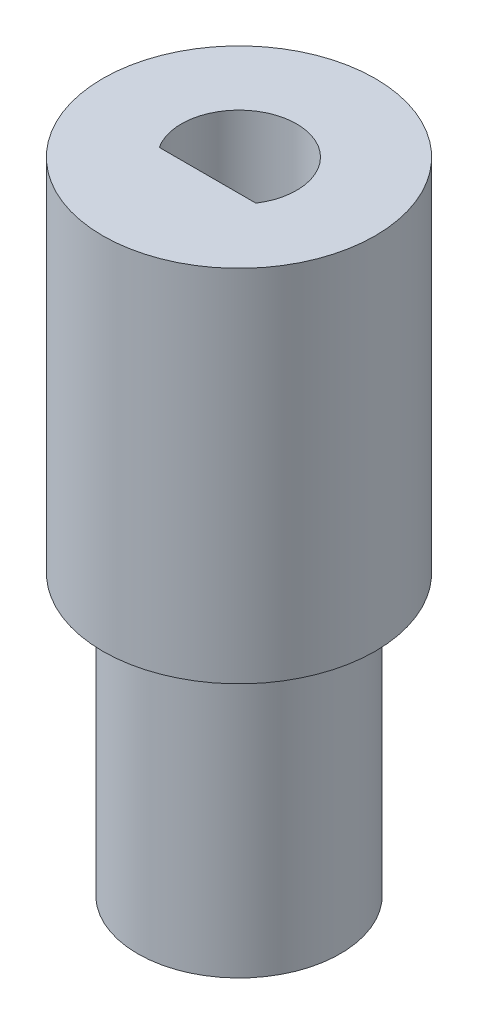
from build123d import *

# Parameters (mm, degrees)
SCHNITT_LINEAR_AUSTRAGEN1_DEPTH = 8
SCHNITT_LINEAR_AUSTRAGEN2_DEPTH = 10


with BuildPart() as part:
    # Skizze1 → Rotation1 (revolve)
    with BuildSketch(Plane.XY, mode=Mode.PRIVATE) as rotation1_sk:
        Polygon((0, 0), (-2.9, 0), (-2.9, 8), (-3.9, 8), (-3.9, 18.3), (0, 18.3), align=None)
    revolve(rotation1_sk.sketch.rotate(Axis((0, 0, 0), (0, 1, 0)), 270), axis=Axis((0, 0, 0), (0, 1, 0)))

    # Skizze3 → Schnitt-Linear austragen1 (cut)
    with BuildSketch(Plane.XZ):
        with BuildLine():
            Line((0.85, 2.244437569), (0.85, 1.25))
            ThreePointArc((0.85, 1.25), (0.967157288, 0.967157288), (1.25, 0.85))
            Line((1.25, 0.85), (2.244437569, 0.85))
            ThreePointArc((2.244437569, 0.85), (2.36078908, 0.432058928), (2.4, 0))
            ThreePointArc((2.4, 0), (2.36078908, -0.432058928), (2.244437569, -0.85))
            Line((2.244437569, -0.85), (1.25, -0.85))
            ThreePointArc((1.25, -0.85), (0.967157288, -0.967157288), (0.85, -1.25))
            Line((0.85, -1.25), (0.85, -2.244437569))
            ThreePointArc((0.85, -2.244437569), (0.432058928, -2.36078908), (0, -2.4))
            ThreePointArc((0, -2.4), (-0.432058928, -2.36078908), (-0.85, -2.244437569))
            Line((-0.85, -2.244437569), (-0.85, -1.25))
            ThreePointArc((-0.85, -1.25), (-0.967157288, -0.967157288), (-1.25, -0.85))
            Line((-1.25, -0.85), (-2.244437569, -0.85))
            ThreePointArc((-2.244437569, -0.85), (-2.36078908, -0.432058928), (-2.4, 0))
            ThreePointArc((-2.4, 0), (-2.36078908, 0.432058928), (-2.244437569, 0.85))
            Line((-2.244437569, 0.85), (-1.25, 0.85))
            ThreePointArc((-1.25, 0.85), (-0.967157288, 0.967157288), (-0.85, 1.25))
            Line((-0.85, 1.25), (-0.85, 2.244437569))
            ThreePointArc((-0.85, 2.244437569), (-0.432058928, 2.36078908), (0, 2.4))
            ThreePointArc((0, 2.4), (0.432058928, 2.36078908), (0.85, 2.244437569))
        make_face()
    extrude(amount=-SCHNITT_LINEAR_AUSTRAGEN1_DEPTH, mode=Mode.SUBTRACT)

    # Skizze4 → Schnitt-Linear austragen2 (cut)
    with BuildSketch(Plane(origin=(0, 18.3, 0), x_dir=(1, 0, 0), z_dir=(0, 1, 0))):
        with BuildLine():
            Line((-1.382931669, -0.9), (1.382931669, -0.9))
            ThreePointArc((1.382931669, -0.9), (0, 1.65), (-1.382931669, -0.9))
        make_face()
    extrude(amount=-SCHNITT_LINEAR_AUSTRAGEN2_DEPTH, mode=Mode.SUBTRACT)


solid = part.part
